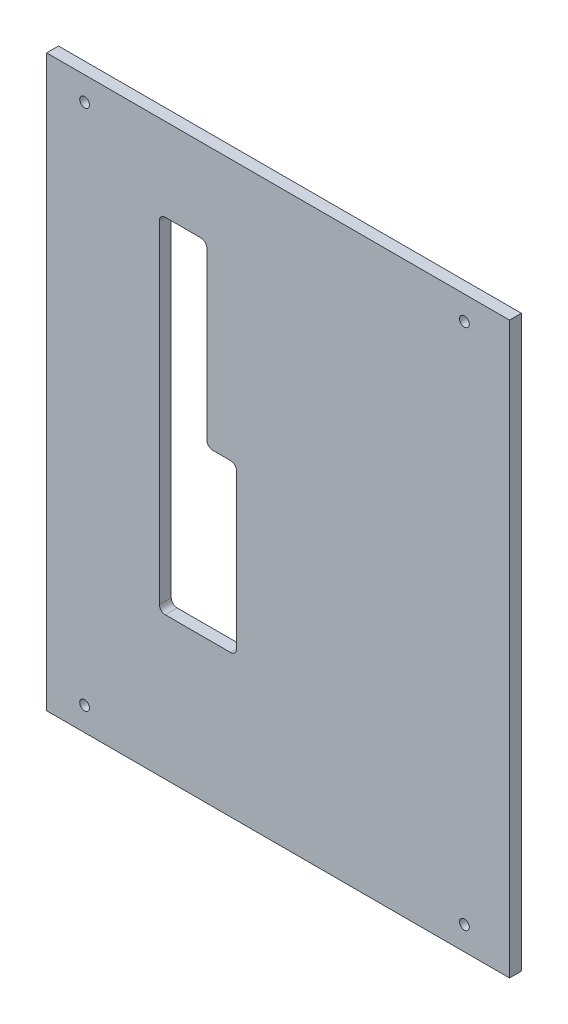
from build123d import *

# Parameters (mm, degrees)
ESQUISSE1_W        = 195
ESQUISSE1_H        = 240
ESQUISSE1_R        = 2.05
ESQUISSE1_W_2      = 32.5
ESQUISSE1_H_2      = 145
ESQUISSE1_W_3      = 12.5
ESQUISSE1_H_3      = 75
BOSS_EXTRU_1_DEPTH = 5
CONG_1_R           = 2.5


with BuildPart() as part:
    # Esquisse1 → Boss.-Extru.1 (new body)
    # profile 1 of 2: a face of its own
    with BuildSketch(Plane.XY):
        with Locations((-22.5, 0)):
            Rectangle(ESQUISSE1_W, ESQUISSE1_H)
        with Locations((56, -110)):
            Circle(ESQUISSE1_R, mode=Mode.SUBTRACT)
        with Locations((56, 110)):
            Circle(ESQUISSE1_R, mode=Mode.SUBTRACT)
        with Locations((-104, 110)):
            Circle(ESQUISSE1_R, mode=Mode.SUBTRACT)
        with Locations((-104, -110)):
            Circle(ESQUISSE1_R, mode=Mode.SUBTRACT)
        with Locations((-56.25, 12.5)):
            Rectangle(ESQUISSE1_W_2, ESQUISSE1_H_2, mode=Mode.SUBTRACT)
    # profile 2 of 2: a face of its own
    with BuildSketch(Plane.XY):
        with Locations((-46.25, 47.5)):
            Rectangle(ESQUISSE1_W_3, ESQUISSE1_H_3)
    extrude(amount=BOSS_EXTRU_1_DEPTH)

    # Congé1
    cong_1_edges = [part.edges().sort_by_distance(p)[0] for p in [
        (-72.5, 85, 2.5),
        (-72.5, -60, 2.5),
        (-40, -60, 2.5),
        (-40, 10, 2.5),
        (-52.5, 10, 2.5),
        (-52.5, 85, 2.5),
    ]]
    fillet(cong_1_edges, radius=CONG_1_R)


solid = part.part
